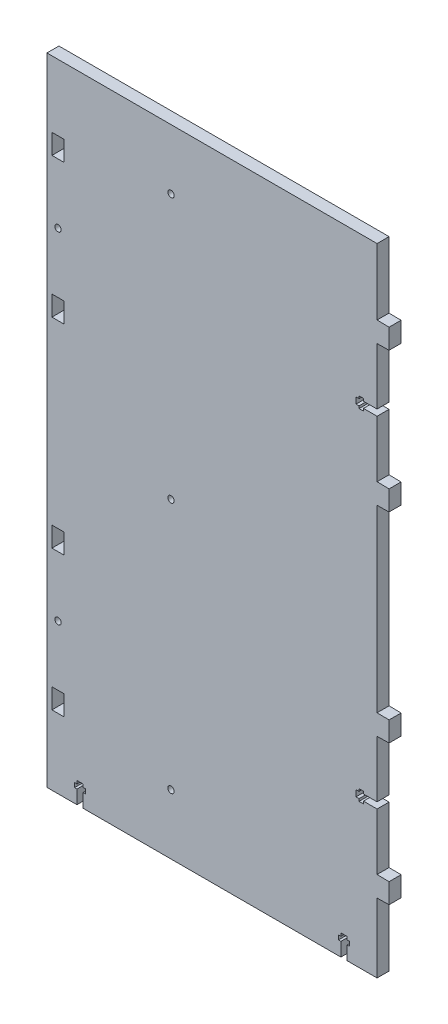
from build123d import *

# Parameters (mm, degrees)
SKETCH_1_R      = 1.6
SKETCH_1_W      = 6.1
SKETCH_1_H      = 10
EXTRUDE_1_DEPTH = 6


with BuildPart() as part:
    # Эскиз1 → Бобышка-Вытянуть1 (new body)
    with BuildSketch(Plane.XY):
        Polygon((1078.719864828, 623.038519), (1084.719864828, 623.138519), (1084.719864828, 633.138519), (1078.719864828, 633.238519), (1078.719864828, 723.038519), (1084.719864828, 723.138519), (1084.719864828, 733.138519), (1078.719864828, 733.238519), (1078.719864828, 761.588519), (1071.919864828, 761.588519), (1071.919864828, 760.388519), (1069.719864828, 760.388519), (1069.719864828, 761.588519), (1068.219864828, 761.588519), (1068.219864828, 764.688519), (1069.719864828, 764.688519), (1069.719864828, 765.888519), (1071.919864828, 765.888519), (1071.919864828, 764.688519), (1078.719864828, 764.688519), (1078.719864828, 793.038519), (1084.719864828, 793.138519), (1084.719864828, 803.138519), (1078.719864828, 803.238519), (1078.719864828, 836.338519), (978.719864828, 836.338519), (913.719864828, 836.338519), (913.719864828, 518.436195), (928.719864828, 518.436195), (928.719864828, 525.236195), (927.519864828, 525.236195), (927.519864828, 527.436195), (928.719864828, 527.436195), (928.719864828, 528.936195), (931.819864828, 528.936195), (931.819864828, 527.436195), (933.019864828, 527.436195), (933.019864828, 525.236195), (931.819864828, 525.236195), (931.819864828, 518.436195), (978.719864828, 518.436195), (1060.619864828, 518.436195), (1060.619864828, 525.236195), (1059.419864828, 525.236195), (1059.419864828, 527.436195), (1060.619864828, 527.436195), (1060.619864828, 528.936195), (1063.719864828, 528.936195), (1063.719864828, 527.436195), (1064.919864828, 527.436195), (1064.919864828, 525.236195), (1063.719864828, 525.236195), (1063.719864828, 518.436195), (1078.719864828, 518.436195), (1078.719864828, 553.038519), (1084.719864828, 553.138519), (1084.719864828, 563.138519), (1078.719864828, 563.238519), (1078.719864828, 591.588519), (1071.919864828, 591.588519), (1071.919864828, 590.388519), (1069.719864828, 590.388519), (1069.719864828, 591.588519), (1068.219864828, 591.588519), (1068.219864828, 594.688519), (1069.719864828, 594.688519), (1069.719864828, 595.888519), (1071.919864828, 595.888519), (1071.919864828, 594.688519), (1078.719864828, 594.688519), align=None)
        with Locations((919.269864828, 593.238519)):
            Circle(SKETCH_1_R, mode=Mode.SUBTRACT)
        with Locations((919.269864828, 763.238519)):
            Circle(SKETCH_1_R, mode=Mode.SUBTRACT)
        with Locations((975.719864828, 806.338519)):
            Circle(SKETCH_1_R, mode=Mode.SUBTRACT)
        with Locations((975.719864828, 674.138519)):
            Circle(SKETCH_1_R, mode=Mode.SUBTRACT)
        with Locations((975.719864828, 548.438519)):
            Circle(SKETCH_1_R, mode=Mode.SUBTRACT)
        with Locations((919.269864828, 558.238519)):
            Rectangle(SKETCH_1_W, SKETCH_1_H, mode=Mode.SUBTRACT)
        with Locations((919.269864828, 628.238519)):
            Rectangle(SKETCH_1_W, SKETCH_1_H, mode=Mode.SUBTRACT)
        with Locations((919.269864828, 728.238519)):
            Rectangle(SKETCH_1_W, SKETCH_1_H, mode=Mode.SUBTRACT)
        with Locations((919.269864828, 798.238519)):
            Rectangle(SKETCH_1_W, SKETCH_1_H, mode=Mode.SUBTRACT)
    extrude(amount=EXTRUDE_1_DEPTH)


solid = part.part
